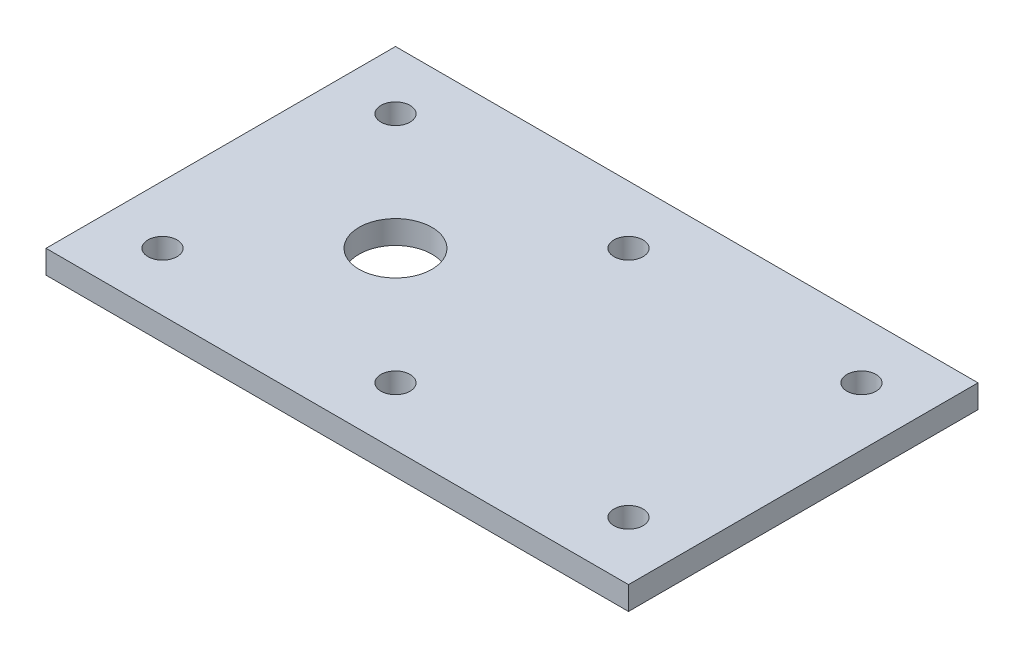
from build123d import *

# Parameters (mm, degrees)
SKETCH1_W            = 200
SKETCH1_H            = 120
BOSS_EXTRUDE5_DEPTH  = 8
SKETCH12_R           = 5
CUT_EXTRUDE1_DEPTH   = 153.52540772
LPATTERN1_COUNT      = 2
LPATTERN1_PITCH      = 80
LPATTERN1_COUNT_DIR2 = 3
LPATTERN1_PITCH_DIR2 = 80
SKETCH13_R           = 12.5
CUT_EXTRUDE2_DEPTH   = 8


with BuildPart() as part:
    # Sketch1 → Boss-Extrude5 (new body)
    with BuildSketch(Plane(origin=(0, 0, 0), x_dir=(1, 0, 0), z_dir=(0, 1, 0))):
        with Locations((40, 0)):
            Rectangle(SKETCH1_W, SKETCH1_H)
    extrude(amount=BOSS_EXTRUDE5_DEPTH)

    # Sketch12 → Cut-Extrude1 (cut, through all)
    with BuildSketch(Plane(origin=(0, 8, 0), x_dir=(1, 0, 0), z_dir=(0, 1, 0))):
        with Locations(Location((-40, 40, 0), (0, 0, 270))):
            Circle(SKETCH12_R)
    cut_extrude1 = extrude(amount=-CUT_EXTRUDE1_DEPTH, mode=Mode.SUBTRACT)

    # LPattern1: Cut-Extrude1 2 × 3
    with Locations(*[(j * LPATTERN1_PITCH_DIR2, 0, i * LPATTERN1_PITCH) for i in range(LPATTERN1_COUNT) for j in range(LPATTERN1_COUNT_DIR2) if (i, j) != (0, 0)]):
        add(cut_extrude1, mode=Mode.SUBTRACT)

    # Sketch13 → Cut-Extrude2 (cut)
    with BuildSketch(Plane(origin=(0, 8, 0), x_dir=(1, 0, 0), z_dir=(0, 1, 0))):
        with Locations(Location((0, 0, 0), (0, 0, 270))):
            Circle(SKETCH13_R)
    extrude(amount=-CUT_EXTRUDE2_DEPTH, mode=Mode.SUBTRACT)


solid = part.part
